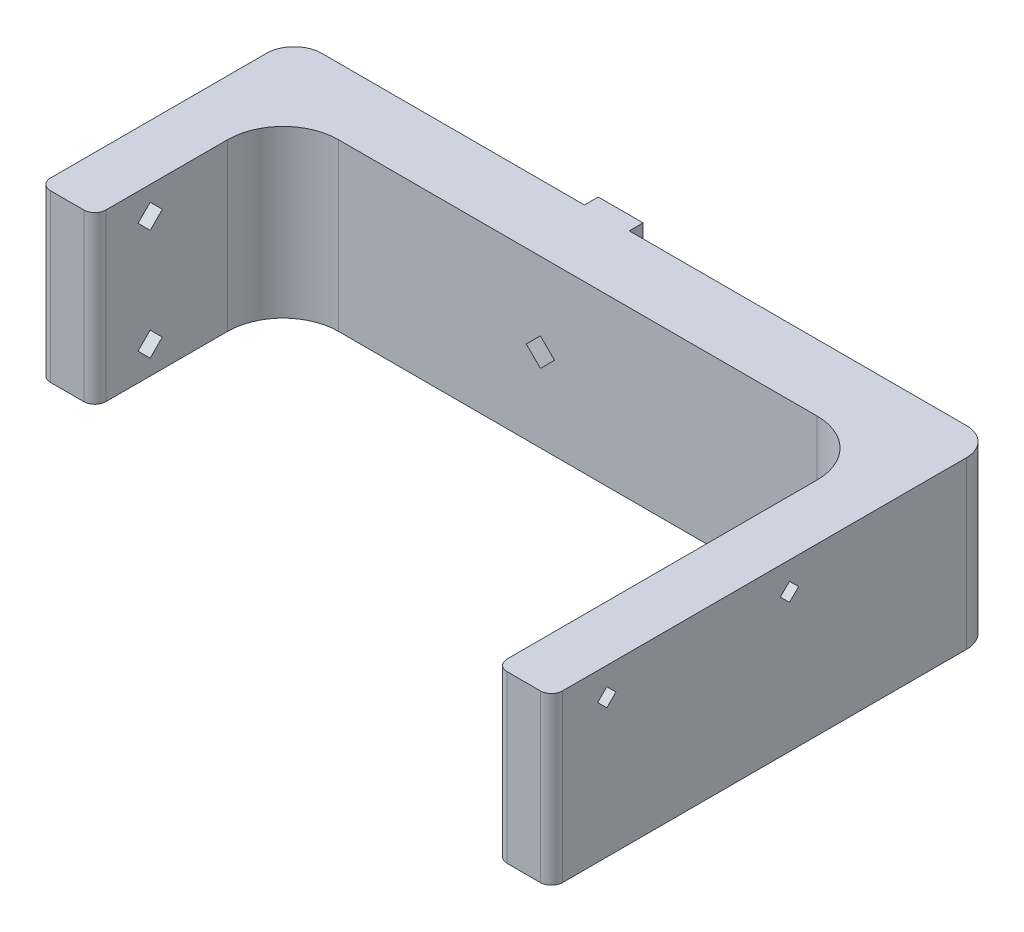
from build123d import *

# Parameters (mm, degrees)
AUFSATZ_LINEAR_AUSTRAGEN1_DEPTH = 30
SKIZZE5_W                       = 8.1
SKIZZE5_H                       = 30
AUFSATZ_LINEAR_AUSTRAGEN2_DEPTH = 3
FASE2_SIZE                      = 0.5
VERRUNDUNG1_R                   = 5
VERRUNDUNG2_R                   = 10
SCHNITT_LINEAR_AUSTRAGEN1_DEPTH = 135.433068848
VERRUNDUNG3_R                   = 2
SCHNITT_LINEAR_AUSTRAGEN2_DEPTH = 97.953597148
SCHNITT_LINEAR_AUSTRAGEN3_DEPTH = 103.097992145


with BuildPart() as part:
    # Skizze1 → Aufsatz-Linear austragen1 (new body)
    with BuildSketch(Plane(origin=(0, 0, 0), x_dir=(1, 0, 0), z_dir=(0, 1, 0))):
        Polygon((-56.5, 0), (-56.5, -26), (-46.5, -26), (-46.5, 8), (60, 8), (60, -60), (70, -60), (70, 0), (70, 20), (-56.5, 20), align=None)
    extrude(amount=AUFSATZ_LINEAR_AUSTRAGEN1_DEPTH)

    # Skizze5 → Aufsatz-Linear austragen2 (add)
    with BuildSketch(Plane(origin=(0, 0, -20), x_dir=(-1, 0, 0), z_dir=(0, 0, -1))):
        with Locations((0, 15)):
            Rectangle(SKIZZE5_W, SKIZZE5_H)
    extrude(amount=AUFSATZ_LINEAR_AUSTRAGEN2_DEPTH)

    # Fase2
    fase2_edges = [part.edges().sort_by_distance(p)[0] for p in [
        (-4.05, 15, -23),
        (0, 0, -23),
        (4.05, 15, -23),
        (0, 30, -23),
    ]]
    chamfer(fase2_edges, length=FASE2_SIZE)

    # Verrundung1
    verrundung1_edges = [part.edges().sort_by_distance(p)[0] for p in [
        (70, 15, -20),
        (-56.5, 15, -20),
    ]]
    fillet(verrundung1_edges, radius=VERRUNDUNG1_R)

    # Verrundung2
    verrundung2_edges = [part.edges().sort_by_distance(p)[0] for p in [
        (60, 15, -8),
        (-46.5, 15, -8),
    ]]
    fillet(verrundung2_edges, radius=VERRUNDUNG2_R)

    # Skizze8 → Schnitt-Linear austragen1 (cut, through all)
    with BuildSketch(Plane.ZY.offset(-60)):
        Polygon((17, 26.65), (15.35, 25), (17, 23.35), (18.65, 25), align=None)
        Polygon((48.35, 25), (50, 26.65), (51.65, 25), (50, 23.35), align=None)
    extrude(amount=-SCHNITT_LINEAR_AUSTRAGEN1_DEPTH, mode=Mode.SUBTRACT)

    # Verrundung3
    verrundung3_edges = [part.edges().sort_by_distance(p)[0] for p in [
        (70, 15, 60),
        (60, 15, 60),
        (-56.5, 15, 26),
        (-46.5, 15, 26),
    ]]
    fillet(verrundung3_edges, radius=VERRUNDUNG3_R)

    # Skizze9 → Schnitt-Linear austragen2 (cut, through all)
    with BuildSketch(Plane(origin=(0, 0, 0), x_dir=(0, 0, -1), z_dir=(1, 0, 0))):
        Polygon((-16, 27.192031022), (-13.807968978, 25), (-16, 22.807968978), (-18.192031022, 25), align=None)
        Polygon((-16, 7.192031022), (-13.807968978, 5), (-16, 2.807968978), (-18.192031022, 5), align=None)
    extrude(amount=-SCHNITT_LINEAR_AUSTRAGEN2_DEPTH, mode=Mode.SUBTRACT)

    # Skizze10 → Schnitt-Linear austragen3 (cut, through all)
    with BuildSketch(Plane.XY.offset(-8)):
        Polygon((0, 17.55), (2.55, 15), (0, 12.45), (-2.55, 15), align=None)
    extrude(amount=-SCHNITT_LINEAR_AUSTRAGEN3_DEPTH, mode=Mode.SUBTRACT)


solid = part.part
